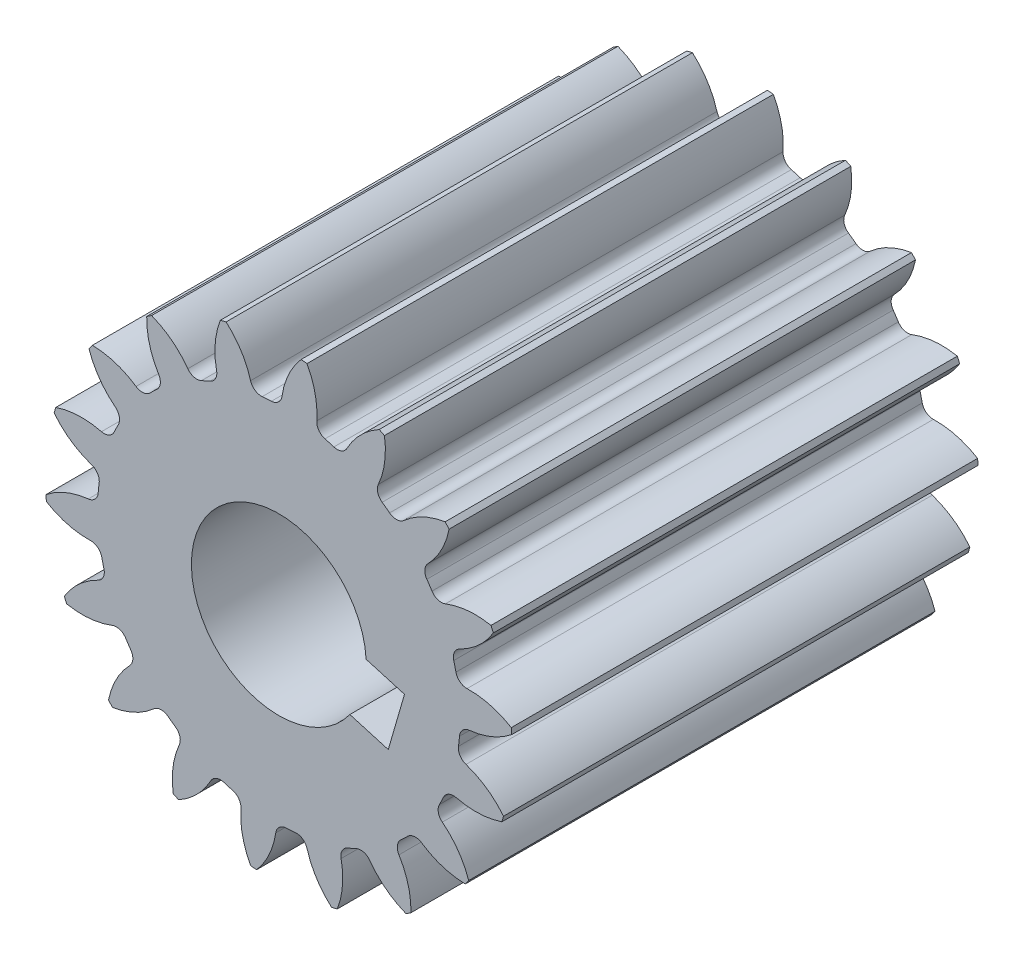
from build123d import *

# Parameters (mm, degrees)
SKETCH3_R         = 20
GEARBODY_DEPTH    = 40
TOOTHCUT_DEPTH    = 49.989794856
CIRPATTERN1_COUNT = 18
BOREDIA_R         = 7.5
BORE_DEPTH        = 12700
KWY1_DEPTH        = 6350


with BuildPart() as part:
    # Sketch3 → gearBody (new body)
    with BuildSketch(Plane.XY):
        Circle(SKETCH3_R)
    extrude(amount=GEARBODY_DEPTH)

    # Sketch2 → toothCut (cut, through all)
    with BuildSketch(Plane.XY):
        with BuildLine():
            ThreePointArc((15.410131867, -2.074959393), (15.458047875, -1.681183079), (15.495903347, -1.286312602))
            ThreePointArc((15.495903347, -1.286312602), (15.763268662, -0.701752182), (16.342213115, -0.422434409))
            ThreePointArc((16.342213115, -0.422434409), (19.177928805, 0.519107216), (21.353959141, 2.566709737))
            ThreePointArc((21.353959141, 2.566709737), (21.381581374, -2.325413473), (20.302931423, -7.097220969))
            ThreePointArc((20.302931423, -7.097220969), (18.617955496, -4.629703952), (16.050944608, -3.100573739))
            ThreePointArc((16.050944608, -3.100573739), (15.545581587, -2.703329086), (15.410131867, -2.074959393))
        make_face()
    toothcut = extrude(amount=TOOTHCUT_DEPTH, mode=Mode.SUBTRACT)

    # CirPattern1: toothCut ×18 about axis
    cirpattern1_axis = Axis((0, 0, 40), (0, 0, -1))
    for i in range(1, CIRPATTERN1_COUNT):
        add(toothcut.rotate(cirpattern1_axis, i * 360 / CIRPATTERN1_COUNT), mode=Mode.SUBTRACT)

    # boreDia → bore (cut, symmetric)
    with BuildSketch(Plane.XY):
        Circle(BOREDIA_R)
    extrude(amount=BORE_DEPTH, both=True, mode=Mode.SUBTRACT)

    # kwy1sketch → kwy1 (cut, symmetric)
    with BuildSketch(Plane.XY):
        Polygon((10.780497106, -0.529983162), (9.384957794, -5.331281948), (3.383334312, -3.586857808), (0, 0), (4.778873624, 1.214440978), align=None)
    extrude(amount=KWY1_DEPTH, both=True, mode=Mode.SUBTRACT)


solid = part.part
